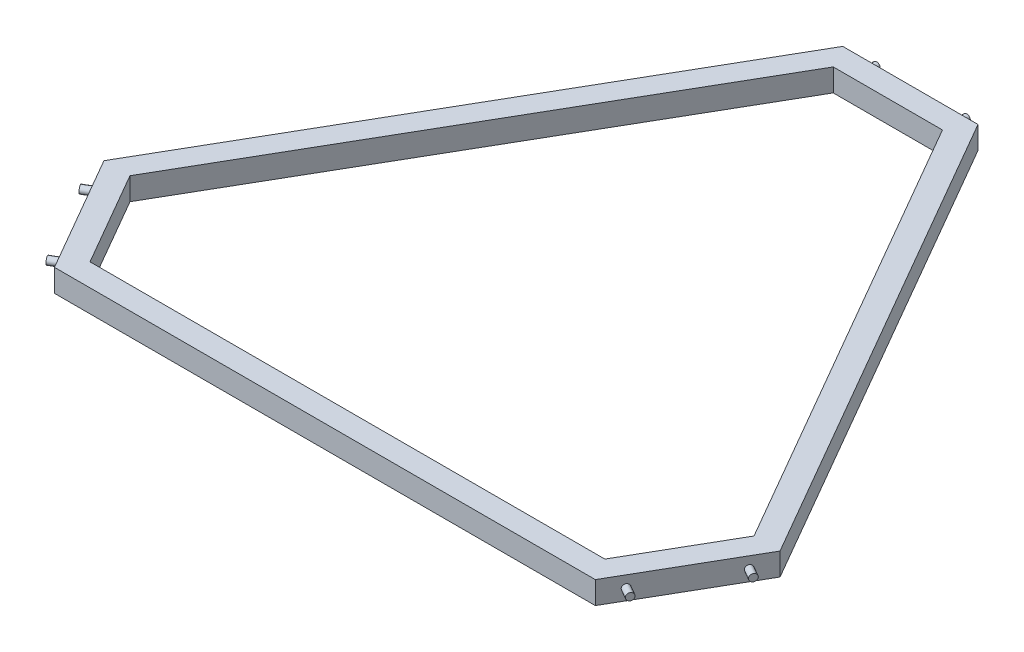
from build123d import *

# Parameters (mm, degrees)
BOSS_EXTRUDE1_DEPTH = 50
SKETCH2_R           = 8
BOSS_EXTRUDE2_DEPTH = 25
CIRPATTERN1_COUNT   = 3


with BuildPart() as part:
    # Sketch1 → Boss-Extrude1 (new body)
    with BuildSketch(Plane(origin=(0, 0, 0), x_dir=(1, 0, 0), z_dir=(0, 1, 0))):
        Polygon((-600, -519.615242271), (600, -519.615242271), (750, -259.807621135), (150, 779.422863406), (-150, 779.422863406), (-750, -259.807621135), align=None)
        Polygon((-121.132486541, 729.422863406), (-692.264973081, -259.807621135), (-571.132486541, -469.615242271), (571.132486541, -469.615242271), (692.264973081, -259.807621135), (121.132486541, 729.422863406), align=None, mode=Mode.SUBTRACT)
    extrude(amount=BOSS_EXTRUDE1_DEPTH)

    # Sketch2 → Boss-Extrude2 (add)
    with BuildSketch(Plane(origin=(675, 0, 389.711431703), x_dir=(0.5000000000000172, 0, -0.8660254037844287), z_dir=(0.8660254037844287, 0, 0.5000000000000172))):
        with Locations((-100, 25)):
            Circle(SKETCH2_R)
        with Locations((100, 25)):
            Circle(SKETCH2_R)
    boss_extrude2 = extrude(amount=BOSS_EXTRUDE2_DEPTH)

    # CirPattern1: Boss-Extrude2 ×3 about axis
    cirpattern1_axis = Axis((0, 52.5, 0), (0, -1, 0))
    for i in range(1, CIRPATTERN1_COUNT):
        add(boss_extrude2.rotate(cirpattern1_axis, i * 360 / CIRPATTERN1_COUNT))


solid = part.part
